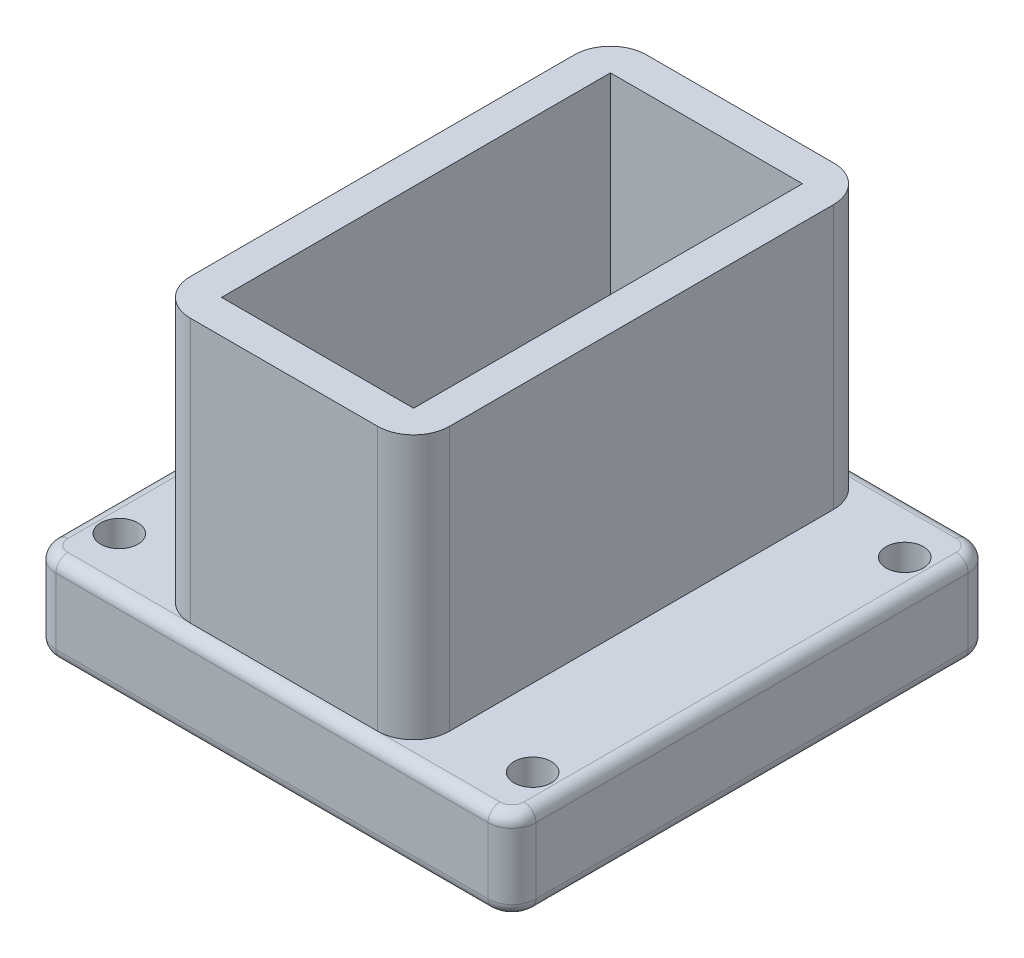
from build123d import *

# Parameters (mm, degrees)
SKETCH1_R           = 1.55
BOSS_EXTRUDE1_DEPTH = 7.5
FILLET2_R           = 1
SKETCH2_R           = 7
CUT_EXTRUDE1_DEPTH  = 10
SKETCH3_W           = 21.6
SKETCH3_H           = 38
SKETCH3_W_2         = 16
SKETCH3_H_2         = 32.4
BOSS_EXTRUDE9_DEPTH = 22
FILLET6_R           = 3


with BuildPart() as part:
    # Sketch1 → Boss-Extrude1 (new body)
    with BuildSketch(Plane(origin=(0, 0, 0), x_dir=(1, 0, 0), z_dir=(0, 1, 0))):
        with BuildLine():
            Line((-18, 20), (18, 20))
            ThreePointArc((18, 20), (19.414213562, 19.414213562), (20, 18))
            Line((20, 18), (20, -18))
            ThreePointArc((20, -18), (19.414213562, -19.414213562), (18, -20))
            Line((18, -20), (-18, -20))
            ThreePointArc((-18, -20), (-19.414213562, -19.414213562), (-20, -18))
            Line((-20, -18), (-20, 18))
            ThreePointArc((-20, 18), (-19.414213562, 19.414213562), (-18, 20))
        make_face()
        with Locations(Location((-17.22, 15.5, 0), (0, 0, 270))):
            Circle(SKETCH1_R, mode=Mode.SUBTRACT)
        with Locations(Location((-17.22, -15.5, 0), (0, 0, 270))):
            Circle(SKETCH1_R, mode=Mode.SUBTRACT)
        with Locations(Location((17.22, 15.5, 0), (0, 0, 270))):
            Circle(SKETCH1_R, mode=Mode.SUBTRACT)
        with Locations(Location((17.22, -15.5, 0), (0, 0, 270))):
            Circle(SKETCH1_R, mode=Mode.SUBTRACT)
    extrude(amount=BOSS_EXTRUDE1_DEPTH)

    # Fillet2
    fillet2_edges = [part.edges().sort_by_distance(p)[0] for p in [
        (0, 0, -20),
        (19.414213562, 0, -19.414213562),
        (20, 0, 0),
        (19.414213562, 0, 19.414213562),
        (19.414213562, 7.5, -19.414213562),
        (0, 7.5, -20),
        (-19.414213562, 7.5, -19.414213562),
        (-20, 7.5, 0),
        (-19.414213562, 7.5, 19.414213562),
        (0, 7.5, 20),
        (19.414213562, 7.5, 19.414213562),
        (0, 0, 20),
        (20, 7.5, 0),
        (-19.414213562, 0, 19.414213562),
        (-20, 0, 0),
        (-19.414213562, 0, -19.414213562),
    ]]
    fillet(fillet2_edges, radius=FILLET2_R)

    # Sketch2 → Cut-Extrude1 (cut)
    with BuildSketch(Plane(origin=(0, 7.5, 0), x_dir=(1, 0, 0), z_dir=(0, 1, 0))):
        with Locations(Location((0, 0, 0), (0, 0, 270))):
            Circle(SKETCH2_R)
    extrude(amount=-CUT_EXTRUDE1_DEPTH, mode=Mode.SUBTRACT)

    # Sketch3 → Boss-Extrude9 (add)
    with BuildSketch(Plane(origin=(0, 7.5, 0), x_dir=(1, 0, 0), z_dir=(0, 1, 0))):
        Rectangle(SKETCH3_W, SKETCH3_H)
        Rectangle(SKETCH3_W_2, SKETCH3_H_2, mode=Mode.SUBTRACT)
    extrude(amount=BOSS_EXTRUDE9_DEPTH)

    # Fillet6
    fillet6_edges = [part.edges().sort_by_distance(p)[0] for p in [
        (-10.8, 18.5, -19),
        (-10.8, 18.5, 19),
        (10.8, 18.5, 19),
        (10.8, 18.5, -19),
    ]]
    fillet(fillet6_edges, radius=FILLET6_R)


solid = part.part
